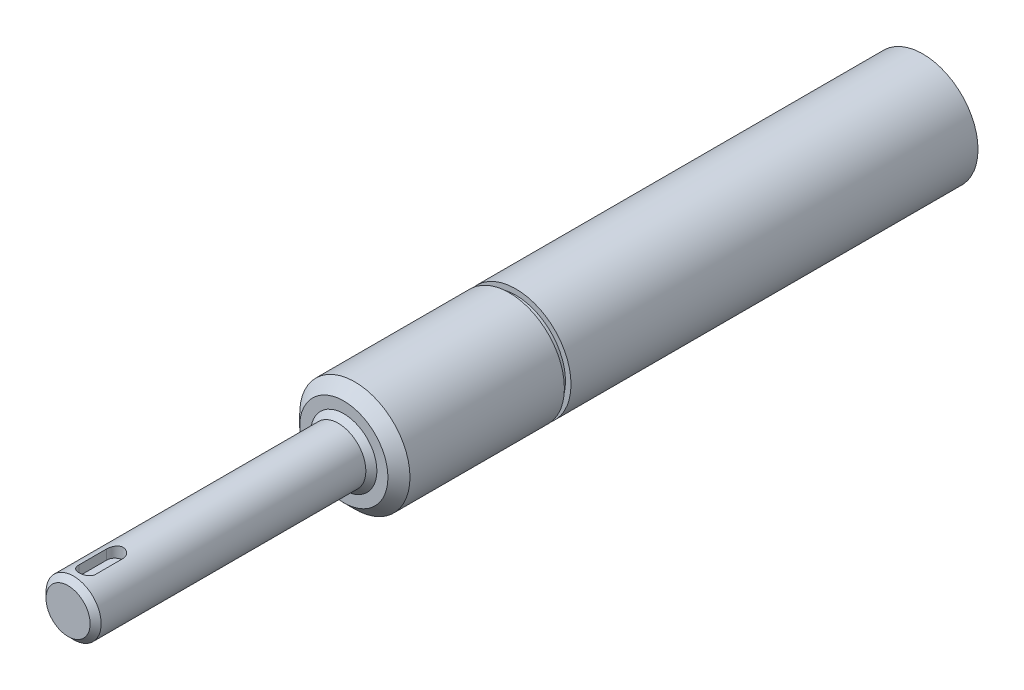
from build123d import *

# Parameters (mm, degrees)
SZKIC1_R                    = 10
DODANIE_WYCI_GNI_CIE1_DEPTH = 105
SZKIC2_R                    = 5
DODANIE_WYCI_GNI_CIE2_DEPTH = 50
WYTNIJ_WYCI_GNI_CIE1_DEPTH  = 2
SFAZOWANIE1_SIZE            = 1
SFAZOWANIE2_SIZE            = 2
SFAZOWANIE3_SIZE            = 1
SZKIC5_W                    = 1
SZKIC5_H                    = 1.2


with BuildPart() as part:
    # Szkic1 → Dodanie-wyciągnięcie1 (new body)
    with BuildSketch(Plane.XY):
        Circle(SZKIC1_R)
    extrude(amount=DODANIE_WYCI_GNI_CIE1_DEPTH)

    # Szkic2 → Dodanie-wyciągnięcie2 (add)
    with BuildSketch(Plane.XY.offset(105)):
        Circle(SZKIC2_R)
    extrude(amount=DODANIE_WYCI_GNI_CIE2_DEPTH)

    # Szkic3 → Wytnij-wyciągnięcie1 (cut)
    with BuildSketch(Plane(origin=(0, 5, 0), x_dir=(1, 0, 0), z_dir=(0, 1, 0))):
        with BuildLine():
            Line((-1.5, -151.5), (-1.5, -146.5))
            ThreePointArc((-1.5, -146.5), (0, -145), (1.5, -146.5))
            Line((1.5, -146.5), (1.5, -151.5))
            ThreePointArc((1.5, -151.5), (0, -153), (-1.5, -151.5))
        make_face()
    extrude(amount=-WYTNIJ_WYCI_GNI_CIE1_DEPTH, mode=Mode.SUBTRACT)

    # Sfazowanie1
    sfazowanie1_edges = [part.edges().sort_by_distance(p)[0] for p in [
        (-5, 0, 105),
    ]]
    chamfer(sfazowanie1_edges, length=SFAZOWANIE1_SIZE)

    # Sfazowanie2
    sfazowanie2_edges = [part.edges().sort_by_distance(p)[0] for p in [
        (-10, 0, 105),
    ]]
    chamfer(sfazowanie2_edges, length=SFAZOWANIE2_SIZE)

    # Sfazowanie3
    sfazowanie3_edges = [part.edges().sort_by_distance(p)[0] for p in [
        (-5, 0, 155),
    ]]
    chamfer(sfazowanie3_edges, length=SFAZOWANIE3_SIZE)

    # Szkic5 → Wycięcie-obrót1 (revolve, cut)
    with BuildSketch(Plane(origin=(0, 0, 0), x_dir=(1, 0, 0), z_dir=(0, 1, 0)), mode=Mode.PRIVATE) as wyci_cie_obr_t1_sk:
        with Locations((-9.5, -74.4)):
            Rectangle(SZKIC5_W, SZKIC5_H)
    revolve(wyci_cie_obr_t1_sk.sketch.rotate(Axis((0, 0, 106), (0, 0, -1)), 180), axis=Axis((0, 0, 106), (0, 0, -1)), mode=Mode.SUBTRACT)


solid = part.part
